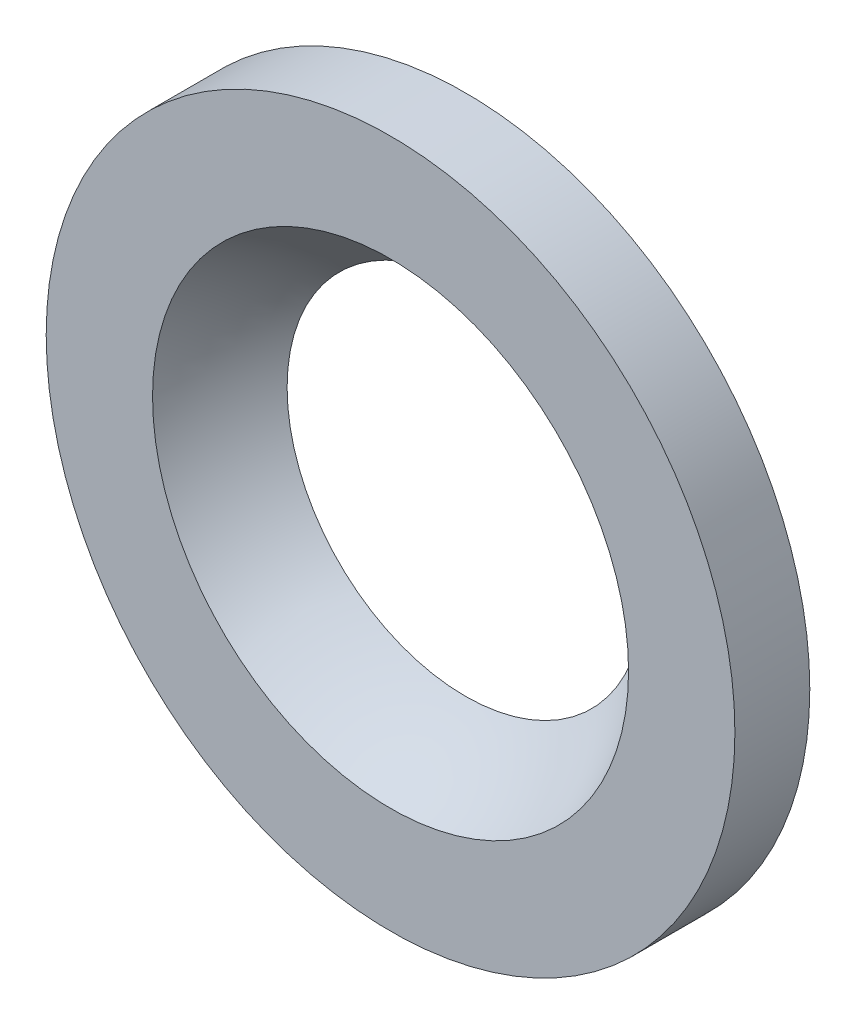
from build123d import *

# Parameters (mm, degrees)
SKETCH2_R           = 32.183564388
BOSS_EXTRUDE1_DEPTH = 7
SKETCH3_R           = 10
CUT_EXTRUDE1_DEPTH  = 47.049577994


with BuildPart() as part:
    # Sketch2 → Boss-Extrude1 (new body)
    with BuildSketch(Plane.XY):
        Circle(SKETCH2_R)
    extrude(amount=BOSS_EXTRUDE1_DEPTH)

    # Sketch3 → Cut-Extrude1 (cut, through all)
    with BuildSketch(Plane.XY.offset(7)):
        Circle(SKETCH3_R)
    extrude(amount=-CUT_EXTRUDE1_DEPTH, mode=Mode.SUBTRACT)

    # Sketch4 → Cut-Revolve1 (revolve, cut)
    with BuildSketch(Plane(origin=(0, 0, 0), x_dir=(1, 0, 0), z_dir=(0, 1, 0))):
        with BuildLine():
            Line((-22.244858179, -7), (0, -7))
            Line((0, -7), (0, 4.212792064))
            Line((0, 4.212792064), (-10, 4.212792064))
            ThreePointArc((-10, 4.212792064), (-17.06939941, -0.359471059), (-22.244858179, -7))
        make_face()
    revolve(axis=Axis((0, 0, -16.764248705), (0, 0, 1)), mode=Mode.SUBTRACT)


solid = part.part
